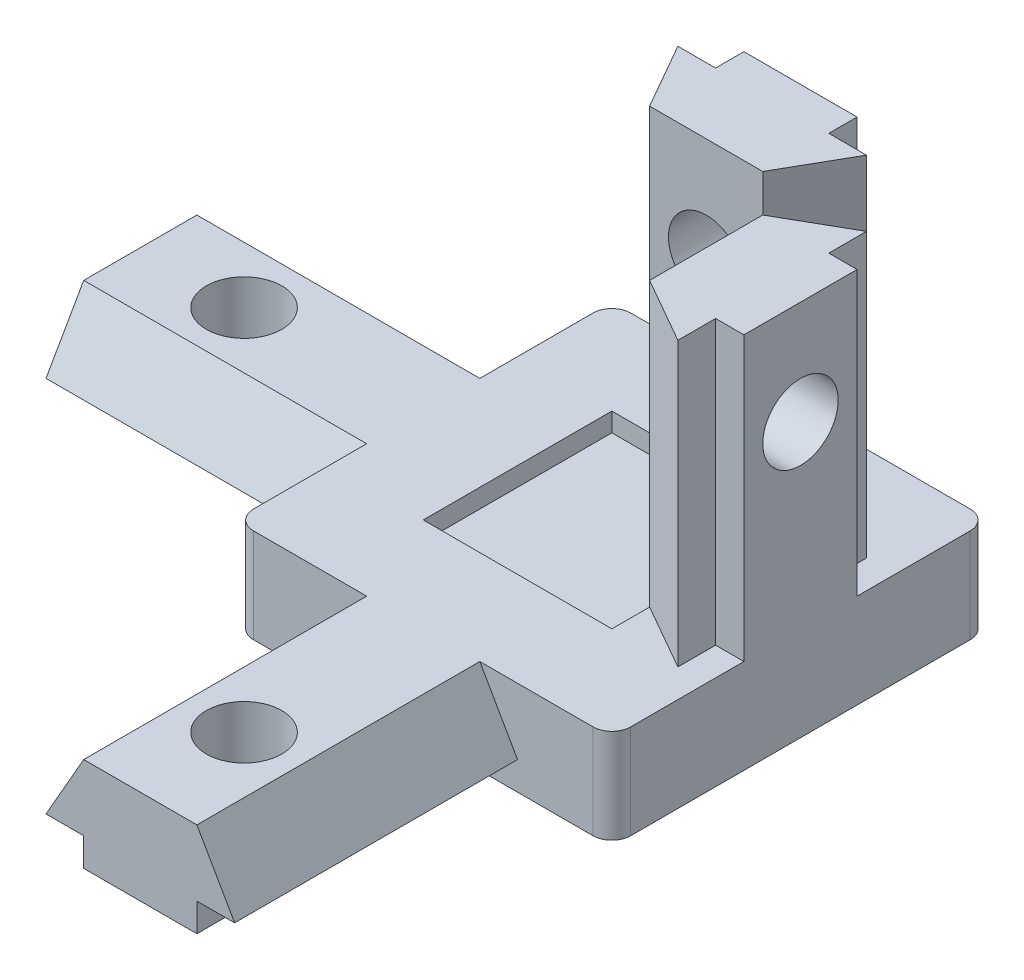
from build123d import *

# Parameters (mm, degrees)
SKETCH_1_W          = 20
SKETCH_1_H          = 20
EXTRUDE_1_DEPTH     = 5
EXTRUDE_2_DEPTH     = 15
EXTRUDE_3_DEPTH     = 15
EXTRUDE_4_DEPTH     = 15
FILLET_1_R          = 1
SKETCH_5_W          = 10
SKETCH_5_H          = 10
CUT_EXTRUDE_1_DEPTH = 1
CUT_EXTRUDE_2_REACH = 40.406
SKETCH_6_R          = 2
CUT_EXTRUDE_3_REACH = 45.875
SKETCH_7_R          = 2
CUT_EXTRUDE_4_REACH = 45.875
SKETCH_8_R          = 2


with BuildPart() as part:
    # 草图1 → 凸台-拉伸1 (new body)
    with BuildSketch(Plane(origin=(0, 0, 0), x_dir=(1, 0, 0), z_dir=(0, 1, 0))):
        Rectangle(SKETCH_1_W, SKETCH_1_H)
    extrude(amount=EXTRUDE_1_DEPTH)

    # 草图2 → 凸台-拉伸2 (add)
    with BuildSketch(Plane.XY.offset(10)):
        Polygon((-3, 5), (3, 5), (5, 1.5), (3, 1.5), (3, 0), (-3, 0), (-3, 1.5), (-5, 1.5), align=None)
    extrude(amount=EXTRUDE_2_DEPTH)

    # 草图3 → 凸台-拉伸3 (add)
    with BuildSketch(Plane.ZY.offset(10)):
        Polygon((-3, 5), (3, 5), (5, 1.5), (3, 1.5), (3, 0), (-3, 0), (-3, 1.5), (-5, 1.5), align=None)
    extrude(amount=EXTRUDE_3_DEPTH)

    # 草图4 → 凸台-拉伸4 (add)
    with BuildSketch(Plane(origin=(0, 5, 0), x_dir=(1, 0, 0), z_dir=(0, 1, 0))):
        Polygon((-3, 10), (-3, 8.5), (-5, 8.5), (-3, 5), (3, 5), (5, 8.5), (3, 8.5), (3, 10), align=None)
        Polygon((8.5, -5), (5, -3), (5, 3), (8.5, 5), (8.5, 3), (10, 3), (10, -3), (8.5, -3), align=None)
    extrude(amount=EXTRUDE_4_DEPTH)

    # 圆角1
    fillet_1_edges = [part.edges().sort_by_distance(p)[0] for p in [
        (10, 2.5, 10),
        (-10, 2.5, 10),
        (-10, 2.5, -10),
        (10, 2.5, -10),
    ]]
    fillet(fillet_1_edges, radius=FILLET_1_R)

    # 草图5 → 切除-拉伸1 (cut)
    with BuildSketch(Plane(origin=(0, 5, 0), x_dir=(1, 0, 0), z_dir=(0, 1, 0))):
        Rectangle(SKETCH_5_W, SKETCH_5_H)
    extrude(amount=-CUT_EXTRUDE_1_DEPTH, mode=Mode.SUBTRACT)

    # 草图6 → 切除-拉伸2 (cut, up to next)
    with BuildSketch(Plane(origin=(0, 5, 0), x_dir=(1, 0, 0), z_dir=(0, 1, 0)), mode=Mode.PRIVATE) as cut_extrude_2_sk1:
        with Locations(Location((0, -19.5, 0), (0, 0, 270))):
            Circle(SKETCH_6_R)
    cut_extrude_2_tool1 = extrude(cut_extrude_2_sk1.sketch, amount=-CUT_EXTRUDE_2_REACH, mode=Mode.PRIVATE) & part.part
    # 草图6 → 切除-拉伸2 (cut, up to next)
    with BuildSketch(Plane(origin=(0, 5, 0), x_dir=(1, 0, 0), z_dir=(0, 1, 0)), mode=Mode.PRIVATE) as cut_extrude_2_sk2:
        with Locations(Location((-19.5, 0, 0), (0, 0, 270))):
            Circle(SKETCH_6_R)
    cut_extrude_2_tool2 = extrude(cut_extrude_2_sk2.sketch, amount=-CUT_EXTRUDE_2_REACH, mode=Mode.PRIVATE) & part.part
    add(cut_extrude_2_tool1.solids().sort_by_distance((0, 5, 19.5))[0], mode=Mode.SUBTRACT)
    add(cut_extrude_2_tool2.solids().sort_by_distance((-19.5, 5, 0))[0], mode=Mode.SUBTRACT)

    # 草图7 → 切除-拉伸3 (cut, up to next)
    with BuildSketch(Plane.ZY.offset(-5), mode=Mode.PRIVATE) as cut_extrude_3_sk1:
        with Locations((0, 14.5)):
            Circle(SKETCH_7_R)
    cut_extrude_3_tool1 = extrude(cut_extrude_3_sk1.sketch, amount=-CUT_EXTRUDE_3_REACH, mode=Mode.PRIVATE) & part.part
    add(cut_extrude_3_tool1.solids().sort_by_distance((5, 14.5, 0))[0], mode=Mode.SUBTRACT)

    # 草图8 → 切除-拉伸4 (cut, up to next)
    with BuildSketch(Plane.XY.offset(-5), mode=Mode.PRIVATE) as cut_extrude_4_sk1:
        with Locations((0, 14.5)):
            Circle(SKETCH_8_R)
    cut_extrude_4_tool1 = extrude(cut_extrude_4_sk1.sketch, amount=-CUT_EXTRUDE_4_REACH, mode=Mode.PRIVATE) & part.part
    add(cut_extrude_4_tool1.solids().sort_by_distance((0, 14.5, -5))[0], mode=Mode.SUBTRACT)


solid = part.part
